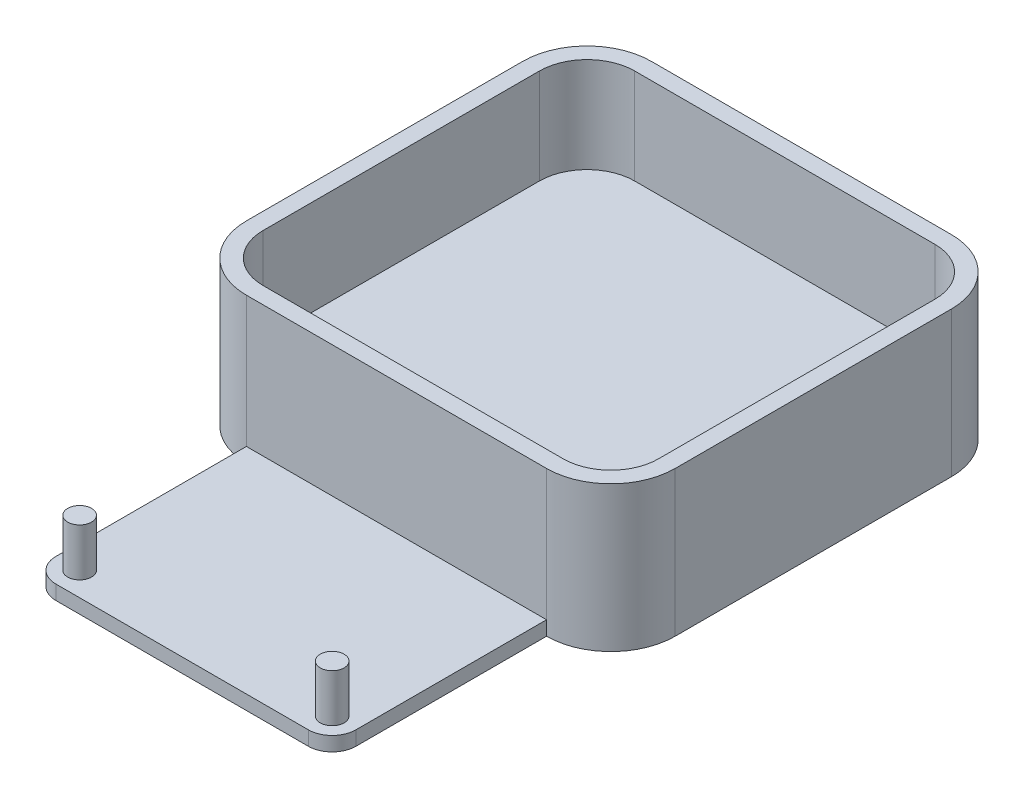
from build123d import *

# Parameters (mm, degrees)
SKETCH1_W           = 90
SKETCH1_H           = 85
SKETCH1_W_2         = 70
SKETCH1_H_2         = 20
BOSS_EXTRUDE1_DEPTH = 7.5
SKETCH2_W           = 90
SKETCH2_H           = 85
BOSS_EXTRUDE2_DEPTH = 3
SKETCH3_W           = 90
SKETCH3_H           = 85
SKETCH3_W_2         = 83
SKETCH3_H_2         = 78
BOSS_EXTRUDE3_DEPTH = 20
FILLET1_R           = 10
FILLET3_R           = 10
FILLET4_R           = 10
FILLET5_R           = 10
FILLET7_R           = 13.5
FILLET8_R           = 13.5
FILLET9_R           = 13.5
FILLET10_R          = 13.5
SKETCH4_W           = 63
SKETCH4_H           = 45
BOSS_EXTRUDE4_DEPTH = 3
FILLET15_R          = 5
FILLET16_R          = 5
SKETCH7_R           = 2.5
BOSS_EXTRUDE6_DEPTH = 10


with BuildPart() as part:
    # Sketch1 → Boss-Extrude1 (new body)
    with BuildSketch(Plane(origin=(0, 0, 0), x_dir=(1, 0, 0), z_dir=(0, 1, 0))):
        with Locations((45, 42.5)):
            Rectangle(SKETCH1_W, SKETCH1_H)
        with Locations((45, 40)):
            Rectangle(SKETCH1_W_2, SKETCH1_H_2, mode=Mode.SUBTRACT)
    extrude(amount=BOSS_EXTRUDE1_DEPTH)

    # Sketch2 → Boss-Extrude2 (add)
    with BuildSketch(Plane(origin=(0, 7.5, 0), x_dir=(1, 0, 0), z_dir=(0, 1, 0))):
        with Locations((45, 42.5)):
            Rectangle(SKETCH2_W, SKETCH2_H)
    extrude(amount=BOSS_EXTRUDE2_DEPTH)

    # Sketch3 → Boss-Extrude3 (add)
    with BuildSketch(Plane(origin=(0, 10.5, 0), x_dir=(1, 0, 0), z_dir=(0, 1, 0))):
        with Locations((45, 42.5)):
            Rectangle(SKETCH3_W, SKETCH3_H)
        with Locations((45, 42.5)):
            Rectangle(SKETCH3_W_2, SKETCH3_H_2, mode=Mode.SUBTRACT)
    extrude(amount=BOSS_EXTRUDE3_DEPTH)

    # Fillet1
    fillet1_edges = [part.edges().sort_by_distance(p)[0] for p in [
        (3.5, 20.5, -81.5),
    ]]
    fillet(fillet1_edges, radius=FILLET1_R)

    # Fillet3
    fillet3_edges = [part.edges().sort_by_distance(p)[0] for p in [
        (86.5, 20.5, -81.5),
    ]]
    fillet(fillet3_edges, radius=FILLET3_R)

    # Fillet4
    fillet4_edges = [part.edges().sort_by_distance(p)[0] for p in [
        (3.5, 20.5, -3.5),
    ]]
    fillet(fillet4_edges, radius=FILLET4_R)

    # Fillet5
    fillet5_edges = [part.edges().sort_by_distance(p)[0] for p in [
        (86.5, 20.5, -3.5),
    ]]
    fillet(fillet5_edges, radius=FILLET5_R)

    # Fillet7
    fillet7_edges = [part.edges().sort_by_distance(p)[0] for p in [
        (0, 15.25, 0),
    ]]
    fillet(fillet7_edges, radius=FILLET7_R)

    # Fillet8
    fillet8_edges = [part.edges().sort_by_distance(p)[0] for p in [
        (90, 15.25, 0),
    ]]
    fillet(fillet8_edges, radius=FILLET8_R)

    # Fillet9
    fillet9_edges = [part.edges().sort_by_distance(p)[0] for p in [
        (90, 15.25, -85),
    ]]
    fillet(fillet9_edges, radius=FILLET9_R)

    # Fillet10
    fillet10_edges = [part.edges().sort_by_distance(p)[0] for p in [
        (0, 15.25, -85),
    ]]
    fillet(fillet10_edges, radius=FILLET10_R)

    # Sketch4 → Boss-Extrude4 (add)
    with BuildSketch(Plane.XZ):
        with Locations((45, 22.5)):
            Rectangle(SKETCH4_W, SKETCH4_H)
    extrude(amount=-BOSS_EXTRUDE4_DEPTH)

    # Fillet15
    fillet15_edges = [part.edges().sort_by_distance(p)[0] for p in [
        (13.5, 1.5, 45),
    ]]
    fillet(fillet15_edges, radius=FILLET15_R)

    # Fillet16
    fillet16_edges = [part.edges().sort_by_distance(p)[0] for p in [
        (76.5, 1.5, 45),
    ]]
    fillet(fillet16_edges, radius=FILLET16_R)

    # Sketch7 → Boss-Extrude6 (add)
    with BuildSketch(Plane(origin=(0, 3, 0), x_dir=(1, 0, 0), z_dir=(0, 1, 0))):
        with Locations(Location((18.5, -40, 0), (0, 0, 270))):
            Circle(SKETCH7_R)
        with Locations(Location((71.5, -40, 0), (0, 0, 270))):
            Circle(SKETCH7_R)
    extrude(amount=BOSS_EXTRUDE6_DEPTH)


solid = part.part
